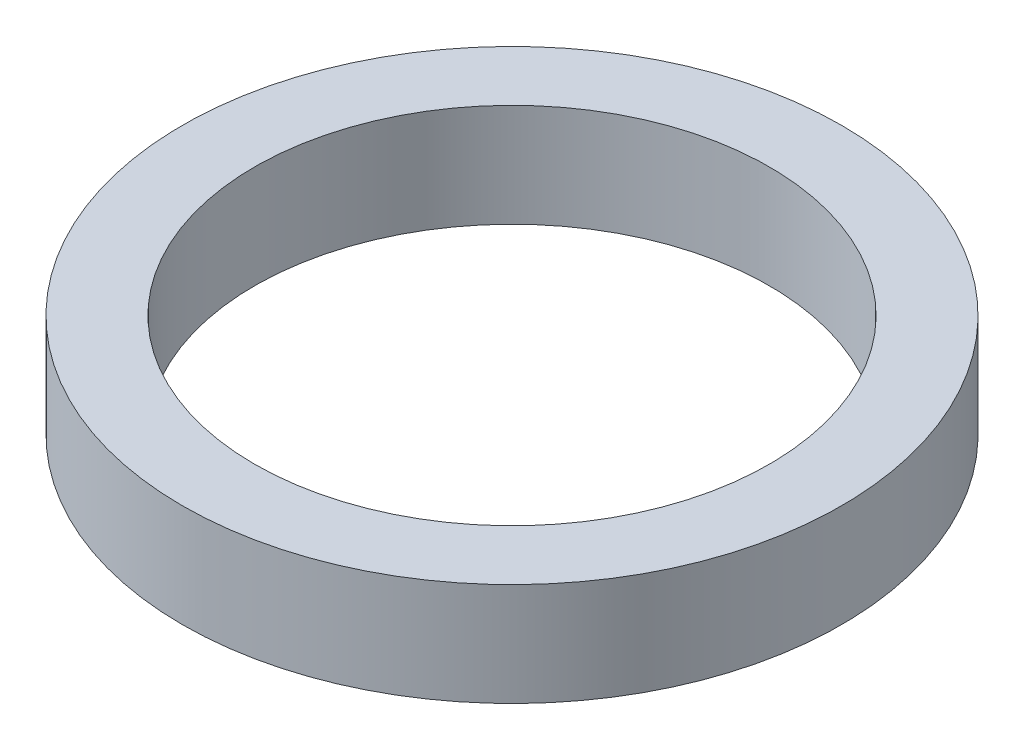
from build123d import *

# Parameters (mm, degrees)
SKETCH1_R           = 8
BOSS_EXTRUDE1_DEPTH = 2.5
SKETCH5_R           = 6.25
CUT_EXTRUDE2_DEPTH  = 25


with BuildPart() as part:
    # Sketch1 → Boss-Extrude1 (new body)
    with BuildSketch(Plane(origin=(0, 0, 0), x_dir=(1, 0, 0), z_dir=(0, 1, 0))):
        with Locations(Location((0, 0, 0), (0, 0, 270))):
            Circle(SKETCH1_R)
    extrude(amount=BOSS_EXTRUDE1_DEPTH)

    # Sketch5 → Cut-Extrude2 (cut, symmetric)
    with BuildSketch(Plane(origin=(0, 2.5, 0), x_dir=(1, 0, 0), z_dir=(0, 1, 0))):
        with Locations(Location((0, 0, 0), (0, 0, 270))):
            Circle(SKETCH5_R)
    extrude(amount=CUT_EXTRUDE2_DEPTH, both=True, mode=Mode.SUBTRACT)


solid = part.part
